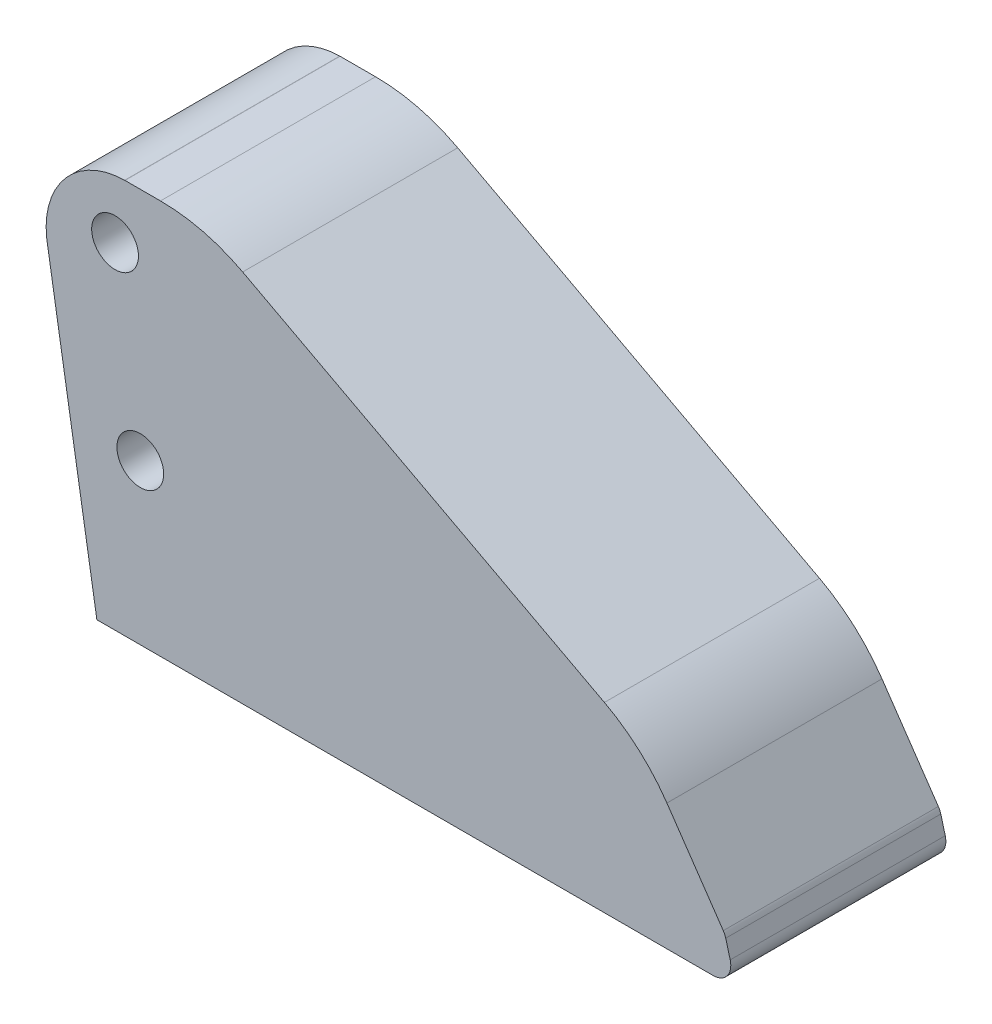
from build123d import *

# Parameters (mm, degrees)
SKETCH1_R           = 4
SKETCH1_W           = 0.443674292
SKETCH1_H           = 0.606573965
SKETCH1_W_2         = 0.441272096
SKETCH1_W_3         = 0.539332563
SKETCH1_W_4         = 0.547504268
SKETCH1_W_5         = 0.686423262
SKETCH1_W_6         = 0.547504269
SKETCH1_W_7         = 0.607984695
SKETCH1_W_8         = 0.472854348
SKETCH1_W_9         = 0.501804613
SKETCH1_W_10        = 0.559705146
SKETCH1_W_11        = 0.321886919
SKETCH1_W_12        = 0.335329484
BOSS_EXTRUDE1_DEPTH = 36.8
SKETCH2_W           = 33.453118401
SKETCH2_H           = 26.8
CUT_EXTRUDE1_DEPTH  = 45
SCALE1_SCALE        = 0.7
BOSS_EXTRUDE2_DEPTH = 25.76


with BuildPart() as part:
    # Sketch1 → Boss-Extrude1 (new body)
    # profile 1 of 15: a face of its own
    with BuildSketch(Plane.XY):
        with BuildLine():
            ThreePointArc((-2.487228681, 2.47588145), (-1.643417841, 0.836304882), (0, 0))
            Line((0, 0), (42.98, -6.863043607))
            ThreePointArc((42.98, -6.863043607), (45.517837276, -6.94186018), (47.993719609, -6.378977628))
            ThreePointArc((47.993719609, -6.378977628), (70.945368499, -4.618817082), (91.44683801, -15.086199743))
            ThreePointArc((91.44683801, -15.086199743), (93.970071754, -16.788756754), (96.888617808, -17.653336321))
            Line((96.888617808, -17.653336321), (96.888617808, -17.138033163))
            Line((96.888617808, -17.138033163), (97.372163904, -17.138033163))
            Line((97.372163904, -17.138033163), (97.653484824, -17.138033163))
            Line((97.653484824, -17.138033163), (98.160101984, -17.138033163))
            Line((98.160101984, -17.138033163), (98.378364418, -17.138033163))
            Line((98.378364418, -17.138033163), (98.82203871, -17.138033163))
            Line((98.82203871, -17.138033163), (99.050846464, -17.138033163))
            Line((99.050846464, -17.138033163), (99.49211856, -17.138033163))
            Line((99.49211856, -17.138033163), (99.769956547, -17.138033163))
            Line((99.769956547, -17.138033163), (100.30928911, -17.138033163))
            Line((100.30928911, -17.138033163), (100.521753453, -17.138033163))
            Line((100.521753453, -17.138033163), (101.069257721, -17.138033163))
            Line((101.069257721, -17.138033163), (101.191833303, -17.138033163))
            Line((101.191833303, -17.138033163), (101.878256565, -17.138033163))
            Line((101.878256565, -17.138033163), (102.04986238, -17.138033163))
            Line((102.04986238, -17.138033163), (102.597366649, -17.138033163))
            Line((102.597366649, -17.138033163), (102.713161539, -17.138033163))
            Line((102.713161539, -17.138033163), (103.321146234, -17.138033163))
            Line((103.321146234, -17.138033163), (103.504651325, -17.138033163))
            Line((103.504651325, -17.138033163), (103.977505673, -17.138033163))
            Line((103.977505673, -17.138033163), (104.180157536, -17.138033163))
            Line((104.180157536, -17.138033163), (104.681962149, -17.138033163))
            Line((104.681962149, -17.138033163), (104.855663746, -17.138033163))
            Line((104.855663746, -17.138033163), (105.415368892, -17.138033163))
            Line((105.415368892, -17.138033163), (105.543243667, -17.138033163))
            Line((105.543243667, -17.138033163), (105.878573151, -17.138033163))
            Line((105.878573151, -17.138033163), (105.984724127, -17.138033163))
            Line((105.984724127, -17.138033163), (106.306611046, -17.138033163))
            Line((106.306611046, -17.138033163), (106.306611046, -17.744607128))
            ThreePointArc((106.306611046, -17.744607128), (108.688292645, -16.568776189), (109.203004303, -13.963002303))
            Line((109.203004303, -13.963002303), (108.439636924, -11.134191555))
            ThreePointArc((108.439636924, -11.134191555), (108.267803288, -10.660099415), (108.018988687, -10.221486316))
            Line((108.018988687, -10.221486316), (98.378364418, 3.865502848))
            ThreePointArc((98.378364418, 3.865502848), (93.609207326, 9.293547423), (87.68053985, 13.423853614))
            Line((87.68053985, 13.423853614), (25.781983162, 46.262452549))
            ThreePointArc((25.781983162, 46.262452549), (18.966543391, 48.873228311), (11.72235753, 49.761001134))
            Line((11.72235753, 49.761001134), (5.64235753, 49.761001134))
            ThreePointArc((5.64235753, 49.761001134), (5.616565931, 49.760890264), (5.590776238, 49.760557663))
            ThreePointArc((5.590776238, 49.760557663), (1.019670875, 48.889839007), (-2.994529703, 46.536256857))
            ThreePointArc((-2.994529703, 46.536256857), (-6.872179638, 41.155169878), (-7.760495561, 34.582258733))
            ThreePointArc((-7.760495561, 34.582258733), (-7.750828994, 34.504551611), (-7.739137581, 34.427123255))
            Line((-7.739137581, 34.427123255), (-2.487228681, 2.47588145))
        make_face()
        with Locations((8.267526818, 9.561727541)):
            Circle(SKETCH1_R, mode=Mode.SUBTRACT)
        with Locations((3.948380067, 39.69588145)):
            Circle(SKETCH1_R, mode=Mode.SUBTRACT)
    # profile 2 of 15: a face of its own
    with BuildSketch(Plane.XY):
        with BuildLine():
            Line((96.888617808, -17.138033163), (96.888617808, -17.653336321))
            ThreePointArc((96.888617808, -17.653336321), (97.130063387, -17.683196177), (97.372163904, -17.707173622))
            Line((97.372163904, -17.707173622), (97.372163904, -17.138033163))
            Line((97.372163904, -17.138033163), (96.888617808, -17.138033163))
        make_face()
    # profile 3 of 15: a face of its own
    with BuildSketch(Plane.XY):
        with BuildLine():
            Line((97.653484824, -17.138033163), (97.653484824, -17.727590841))
            ThreePointArc((97.653484824, -17.727590841), (97.906687423, -17.739163166), (98.160101984, -17.744314442))
            Line((98.160101984, -17.744314442), (98.160101984, -17.138033163))
            Line((98.160101984, -17.138033163), (97.653484824, -17.138033163))
        make_face()
    # profile 4 of 15: a face of its own
    with BuildSketch(Plane.XY):
        with Locations((98.600201564, -17.441320146)):
            Rectangle(SKETCH1_W, SKETCH1_H)
    # profile 5 of 15: a face of its own
    with BuildSketch(Plane.XY):
        with Locations((99.271482512, -17.441320146)):
            Rectangle(SKETCH1_W_2, SKETCH1_H)
    # profile 6 of 15: a face of its own
    with BuildSketch(Plane.XY):
        with Locations((100.039622829, -17.441320146)):
            Rectangle(SKETCH1_W_3, SKETCH1_H)
    # profile 7 of 15: a face of its own
    with BuildSketch(Plane.XY):
        with Locations((100.795505587, -17.441320146)):
            Rectangle(SKETCH1_W_4, SKETCH1_H)
    # profile 8 of 15: a face of its own
    with BuildSketch(Plane.XY):
        with Locations((101.535044934, -17.441320146)):
            Rectangle(SKETCH1_W_5, SKETCH1_H)
    # profile 9 of 15: a face of its own
    with BuildSketch(Plane.XY):
        with Locations((102.323614515, -17.441320146)):
            Rectangle(SKETCH1_W_6, SKETCH1_H)
    # profile 10 of 15: a face of its own
    with BuildSketch(Plane.XY):
        with Locations((103.017153887, -17.441320146)):
            Rectangle(SKETCH1_W_7, SKETCH1_H)
    # profile 11 of 15: a face of its own
    with BuildSketch(Plane.XY):
        with Locations((103.741078499, -17.441320146)):
            Rectangle(SKETCH1_W_8, SKETCH1_H)
    # profile 12 of 15: a face of its own
    with BuildSketch(Plane.XY):
        with Locations((104.431059843, -17.441320146)):
            Rectangle(SKETCH1_W_9, SKETCH1_H)
    # profile 13 of 15: a face of its own
    with BuildSketch(Plane.XY):
        with Locations((105.135516319, -17.441320146)):
            Rectangle(SKETCH1_W_10, SKETCH1_H)
    # profile 14 of 15: a face of its own
    with BuildSketch(Plane.XY):
        with Locations((106.145667586, -17.441320146)):
            Rectangle(SKETCH1_W_11, SKETCH1_H)
    # profile 15 of 15: a face of its own
    with BuildSketch(Plane.XY):
        with Locations((105.710908409, -17.441320146)):
            Rectangle(SKETCH1_W_12, SKETCH1_H)
    extrude(amount=BOSS_EXTRUDE1_DEPTH)

    # Sketch2 → Cut-Extrude1 (cut)
    with BuildSketch(Plane(origin=(0, -40, 0), x_dir=(1, 0, 0), z_dir=(0, 1, 0))):
        with Locations((69.72027881, -18.4)):
            Rectangle(SKETCH2_W, SKETCH2_H)
    extrude(amount=CUT_EXTRUDE1_DEPTH, mode=Mode.SUBTRACT)


with BuildPart() as part_1:
    # Scale1: scaled about (39.860062577, 16.282698439, 18.4)
    add(part.part.scale(SCALE1_SCALE).moved(Location((11.958018773, 4.884809532, 5.52))))

    # Sketch3 → Boss-Extrude2 (add)
    with BuildSketch(Plane.XY.offset(31.28)):
        Polygon((10.216958697, 6.617926547), (12.543544787, -7.536415458), (86.372646506, -7.536415458), (86.372646506, -6.950234368), (60.81181541, 6.617926547), align=None)
    extrude(amount=-BOSS_EXTRUDE2_DEPTH)


solid = part_1.part
